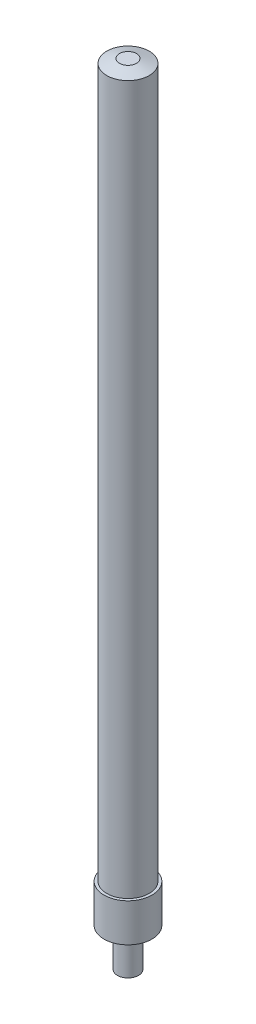
from build123d import *


with BuildPart() as part:
    # Sketch1 → Revolve1 (revolve)
    with BuildSketch(Plane.XY, mode=Mode.PRIVATE) as revolve1_sk:
        Polygon((0, 561.975), (6.35, 561.975), (15.875, 558.8), (15.875, 28.575), (17.9451, 28.575), (17.9451, 0), (7.8867, 0), (7.8867, -28.575), (0, -28.575), align=None)
    revolve(revolve1_sk.sketch.rotate(Axis((0, 561.975, 0), (0, -1, 0)), 90), axis=Axis((0, 561.975, 0), (0, -1, 0)))


solid = part.part
